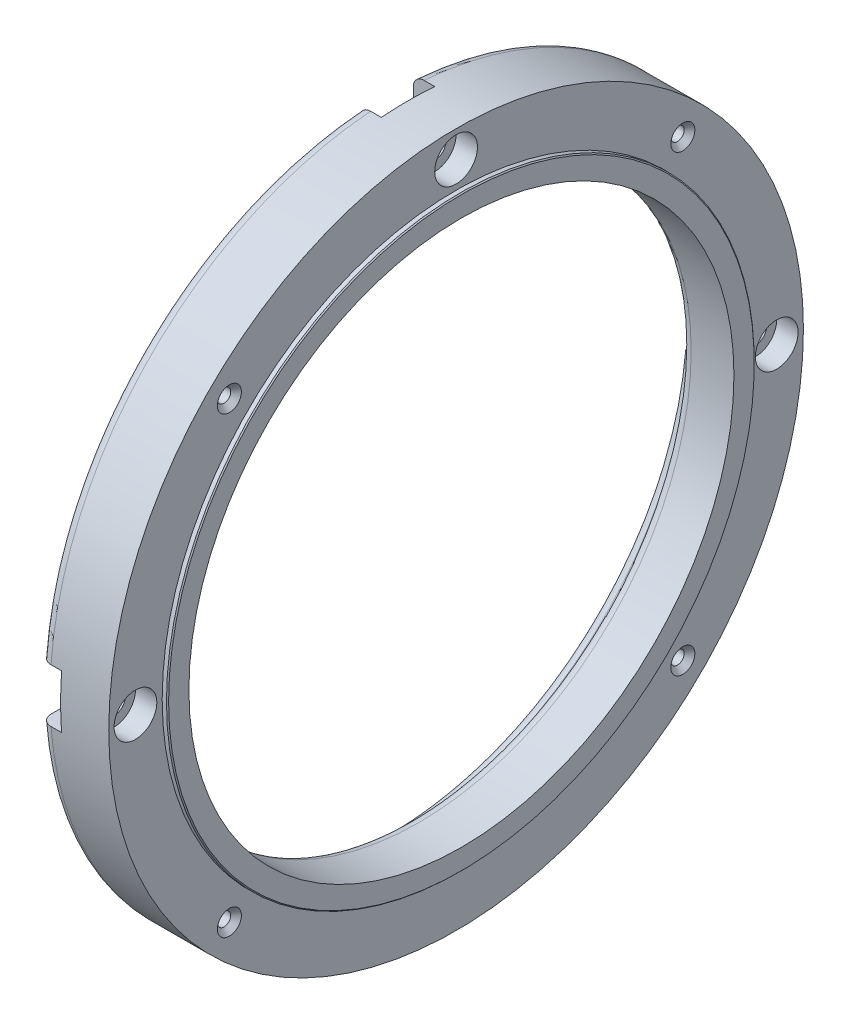
from build123d import *

# Parameters (mm, degrees)
CONG_1_R                                           = 2
ENL_V_MAT_EXTRU_1_DEPTH                            = 4
CHAMBRAGE_POUR_VIS_T_TE_HEXAGONALE_M41_D           = 4.3
CHAMBRAGE_POUR_VIS_T_TE_HEXAGONALE_M41_CBORE_D     = 8
CHAMBRAGE_POUR_VIS_T_TE_HEXAGONALE_M41_CBORE_DEPTH = 5
CHANFREIN1_SIZE                                    = 0.2
TROU_TARAUD_M31_D                                  = 2.5
TROU_TARAUD_M31_CSINK_D                            = 4.5
TROU_TARAUD_M31_CSINK_ANGLE                        = 90


with BuildPart() as part:
    # Esquisse1 → Révolution1 (revolve)
    with BuildSketch(Plane.XY, mode=Mode.PRIVATE) as r_volution1_sk:
        Polygon((0, 55), (0, 65), (13, 65), (13, 55), (14, 55), (14, 51), (4, 51), (4, 55), align=None)
    revolve(r_volution1_sk.sketch.rotate(Axis((0, 0, 0), (1, 0, 0)), 90), axis=Axis((0, 0, 0), (1, 0, 0)))

    # Congé1
    cong_1_edges = [part.edges().sort_by_distance(p)[0] for p in [
        (4, 0, -51),
        (0, 0, -65),
        (0, 0, -55),
    ]]
    fillet(cong_1_edges, radius=CONG_1_R)

    # Esquisse5 → Enlèv. mat.-Extru.1 (cut)
    with BuildSketch(Plane.ZY):
        Polygon((-5, 80), (-5, 5), (-80, 5), (-80, -5), (-5, -5), (5, -5), (80, -5), (80, 5), (5, 5), (5, 80), align=None)
    extrude(amount=-ENL_V_MAT_EXTRU_1_DEPTH, mode=Mode.SUBTRACT)

    # Chambrage pour vis à tête hexagonale M41 (through all)
    with Locations(Plane(origin=(14, 0, 0), x_dir=(0, 0, -1), z_dir=(1, 0, 0))):
        with Locations((60, 0), (-60, 0), (0, 60)):
            CounterBoreHole(CHAMBRAGE_POUR_VIS_T_TE_HEXAGONALE_M41_D / 2, CHAMBRAGE_POUR_VIS_T_TE_HEXAGONALE_M41_CBORE_D / 2, CHAMBRAGE_POUR_VIS_T_TE_HEXAGONALE_M41_CBORE_DEPTH)

    # Chanfrein1
    chanfrein1_edges = [part.edges().sort_by_distance(p)[0] for p in [
        (14, 0, -55),
    ]]
    chamfer(chanfrein1_edges, length=CHANFREIN1_SIZE)

    # Trou taraudé M31 (through all)
    with Locations(Plane(origin=(13, 0, 0), x_dir=(0, 0, -1), z_dir=(1, 0, 0))):
        with Locations((-42.426406871, 42.426406871), (42.426406871, 42.426406871), (42.426406871, -42.426406871), (-42.426406871, -42.426406871)):
            CounterSinkHole(TROU_TARAUD_M31_D / 2, TROU_TARAUD_M31_CSINK_D / 2, counter_sink_angle=TROU_TARAUD_M31_CSINK_ANGLE)


solid = part.part
